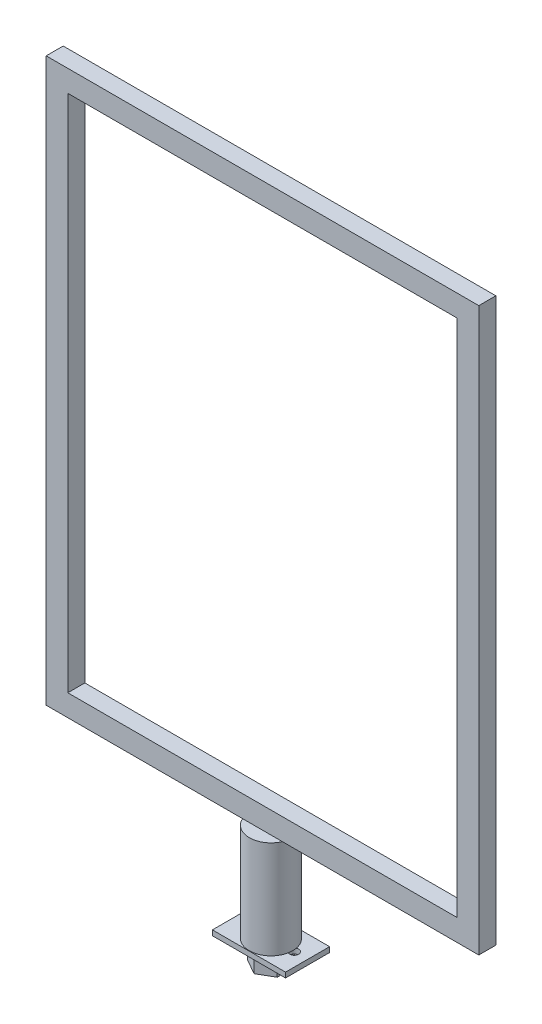
from build123d import *

# Parameters (mm, degrees)
BOSS_EXTRUDE1_DEPTH      = 10
SKETCH2_W                = 42.944936058
SKETCH2_H                = 25.863004624
SKETCH2_R                = 2.6
BOSS_EXTRUDE2_DEPTH      = 3
SKETCH3_R                = 12.7
BOSS_EXTRUDE5_DEPTH      = 57.47647
BOSS_EXTRUDE4_DEPTH      = 5
BOSS_EXTRUDE4_DEPTH_BACK = 5
SKETCH4_W                = 254
SKETCH4_H                = 330.2
SKETCH4_W_2              = 228.6
SKETCH4_H_2              = 304.8


with BuildPart() as part:
    # Sketch1 → Boss-Extrude1 (new body)
    with BuildSketch(Plane(origin=(0, 0, 0), x_dir=(1, 0, 0), z_dir=(0, 1, 0))):
        Polygon((0, 10), (-8.660254038, 5), (-8.660254038, -5), (0, -10), (8.660254038, -5), (8.660254038, 5), align=None)
    extrude(amount=BOSS_EXTRUDE1_DEPTH)

    # Sketch2 → Boss-Extrude2 (add)
    with BuildSketch(Plane(origin=(0, 10, 0), x_dir=(1, 0, 0), z_dir=(0, 1, 0))):
        Rectangle(SKETCH2_W, SKETCH2_H)
        with Locations(Location((-13.660254038, 0, 0), (0, 0, 270))):
            Circle(SKETCH2_R, mode=Mode.SUBTRACT)
        with Locations(Location((13.660254038, 0, 0), (0, 0, 90))):
            Circle(SKETCH2_R, mode=Mode.SUBTRACT)
    extrude(amount=BOSS_EXTRUDE2_DEPTH)

    # Sketch3 → Boss-Extrude5 (add)
    with BuildSketch(Plane(origin=(0, 13, 0), x_dir=(1, 0, 0), z_dir=(0, 1, 0))):
        with Locations(Location((0, 0, 0), (0, 0, 10.525215122))):
            Circle(SKETCH3_R)
    extrude(amount=BOSS_EXTRUDE5_DEPTH)

    # Sketch4 → Boss-Extrude4 (add, two sides: drawn at the far end of the back side and taken through both)
    with BuildSketch(Plane.XY.offset(-BOSS_EXTRUDE4_DEPTH_BACK)):
        with Locations((0, 235.57647)):
            Rectangle(SKETCH4_W, SKETCH4_H)
        with Locations((0, 235.57647)):
            Rectangle(SKETCH4_W_2, SKETCH4_H_2, mode=Mode.SUBTRACT)
    extrude(amount=BOSS_EXTRUDE4_DEPTH + BOSS_EXTRUDE4_DEPTH_BACK)


solid = part.part
